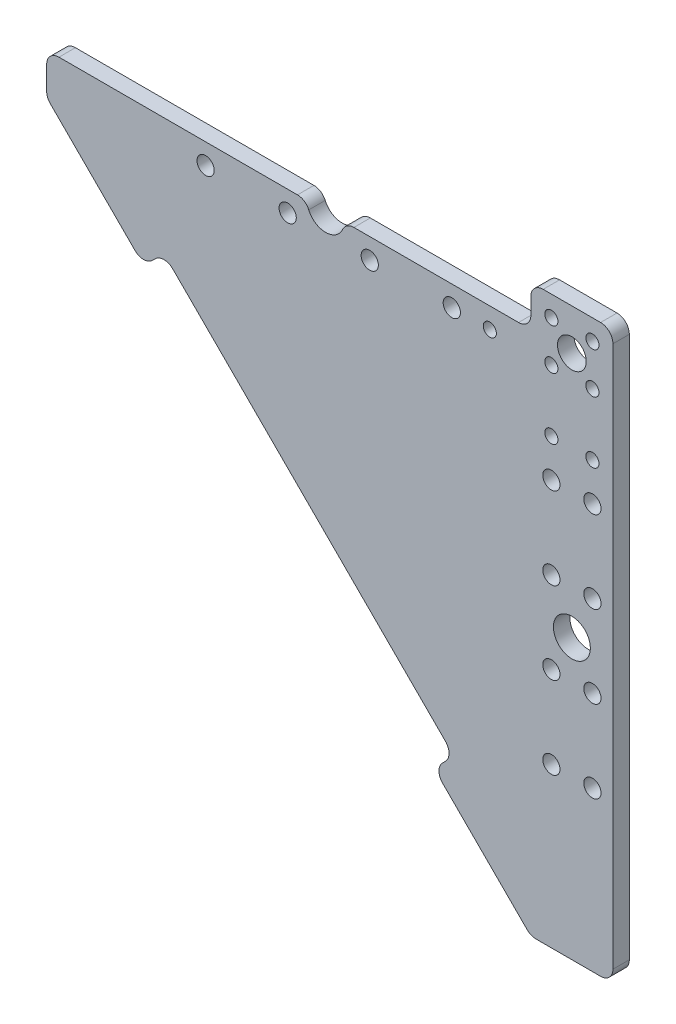
from build123d import *

# Parameters (mm, degrees)
SKETCH_1_W          = 118
SKETCH_1_H          = 20
SKETCH_1_W_2        = 20
SKETCH_1_H_2        = 118
EXTRUDE_1_DEPTH     = 4
SKETCH_3_R          = 3.5
SKETCH_3_R_2        = 1.6
CUT_EXTRUDE_1_DEPTH = 4
SKETCH_4_R          = 4.5
SKETCH_4_R_2        = 2.1
CUT_EXTRUDE_2_DEPTH = 4
CUT_EXTRUDE_7_DEPTH = 4
SKETCH_12_W         = 118
SKETCH_12_H         = 10
CUT_EXTRUDE_8_DEPTH = 4
FILLET_3_R          = 3


with BuildPart() as part:
    # 草图1 → 凸台-拉伸1 (new body)
    with BuildSketch(Plane.XY):
        with Locations((-69, 0)):
            Rectangle(SKETCH_1_W, SKETCH_1_H)
        Rectangle(SKETCH_1_W_2, SKETCH_1_H)
        with Locations((0, -69)):
            Rectangle(SKETCH_1_W_2, SKETCH_1_H_2)
        Polygon((-128, -10), (-10, -10), (-10, -128), align=None)
    extrude(amount=EXTRUDE_1_DEPTH)

    # 草图3 → 切除-拉伸1 (cut)
    with BuildSketch(Plane.XY.offset(4)):
        Circle(SKETCH_3_R)
        with Locations((5, 5)):
            Circle(SKETCH_3_R_2)
        with Locations((-5, 5)):
            Circle(SKETCH_3_R_2)
        with Locations((-5, -5)):
            Circle(SKETCH_3_R_2)
        with Locations((5, -5)):
            Circle(SKETCH_3_R_2)
        with Locations((-20, -5)):
            Circle(SKETCH_3_R_2)
        with Locations((-5, -20)):
            Circle(SKETCH_3_R_2)
        with Locations((5, -20)):
            Circle(SKETCH_3_R_2)
        with Locations((5, 20)):
            Circle(SKETCH_3_R_2)
        with Locations((-5, 20)):
            Circle(SKETCH_3_R_2)
        with Locations((20, -5)):
            Circle(SKETCH_3_R_2)
        with Locations((20, 5)):
            Circle(SKETCH_3_R_2)
        with Locations((-20, 5)):
            Circle(SKETCH_3_R_2)
    extrude(amount=-CUT_EXTRUDE_1_DEPTH, mode=Mode.SUBTRACT)

    # 草图4 → 切除-拉伸2 (cut)
    with BuildSketch(Plane.XY.offset(4)):
        with Locations((0, -60)):
            Circle(SKETCH_4_R)
        with Locations((-5, -29.263884189)):
            Circle(SKETCH_4_R_2)
        with Locations((5, -29.263884189)):
            Circle(SKETCH_4_R_2)
        with Locations((5, -49.263884189)):
            Circle(SKETCH_4_R_2)
        with Locations((5, -69.263884189)):
            Circle(SKETCH_4_R_2)
        with Locations((5, -89.263884189)):
            Circle(SKETCH_4_R_2)
        with Locations((-5, -49.263884189)):
            Circle(SKETCH_4_R_2)
        with Locations((-5, -69.263884189)):
            Circle(SKETCH_4_R_2)
        with Locations((-5, -89.263884189)):
            Circle(SKETCH_4_R_2)
        with Locations(Location((-89.263884189, -5, 0), (0, 0, 180))):
            Circle(SKETCH_4_R_2)
        with Locations(Location((-69.263884189, -5, 0), (0, 0, 180))):
            Circle(SKETCH_4_R_2)
        with Locations(Location((-49.263884189, -5, 0), (0, 0, 180))):
            Circle(SKETCH_4_R_2)
        with Locations(Location((-89.263884189, 5, 0), (0, 0, 180))):
            Circle(SKETCH_4_R_2)
        with Locations(Location((-69.263884189, 5, 0), (0, 0, 180))):
            Circle(SKETCH_4_R_2)
        with Locations(Location((-49.263884189, 5, 0), (0, 0, 180))):
            Circle(SKETCH_4_R_2)
        with Locations(Location((-29.263884189, 5, 0), (0, 0, 180))):
            Circle(SKETCH_4_R_2)
        with Locations(Location((-29.263884189, -5, 0), (0, 0, 180))):
            Circle(SKETCH_4_R_2)
        with Locations(Location((-60, 0, 0), (0, 0, 180))):
            Circle(SKETCH_4_R)
    extrude(amount=-CUT_EXTRUDE_2_DEPTH, mode=Mode.SUBTRACT)

    # 草图11 → 切除-拉伸7 (cut)
    with BuildSketch(Plane.XY.offset(4)):
        Polygon((-69, -69), (-64.050252532, -64.050252532), (-99.405591591, -28.694913472), (-104.355339059, -33.644660941), align=None)
        Polygon((-28.694913472, -99.405591591), (-64.050252532, -64.050252532), (-69, -69), (-33.644660941, -104.355339059), align=None)
    extrude(amount=-CUT_EXTRUDE_7_DEPTH, mode=Mode.SUBTRACT)

    # 草图12 → 切除-拉伸8 (cut)
    with BuildSketch(Plane.XY.offset(4)):
        with Locations((-69, 5)):
            Rectangle(SKETCH_12_W, SKETCH_12_H)
    extrude(amount=-CUT_EXTRUDE_8_DEPTH, mode=Mode.SUBTRACT)

    # 圆角3
    fillet_3_edges = [part.edges().sort_by_distance(p)[0] for p in [
        (10, 10, 2),
        (10, -128, 2),
        (-10, -128, 2),
        (-128, -10, 2),
        (-99.405591591, -28.694913472, 2),
        (-28.694913472, -99.405591591, 2),
        (-33.644660941, -104.355339059, 2),
        (-104.355339059, -33.644660941, 2),
        (-64.5, 0, 2),
        (-55.5, 0, 2),
        (-10, 0, 2),
        (-128, 0, 2),
        (-10, 10, 2),
    ]]
    fillet(fillet_3_edges, radius=FILLET_3_R)


solid = part.part
